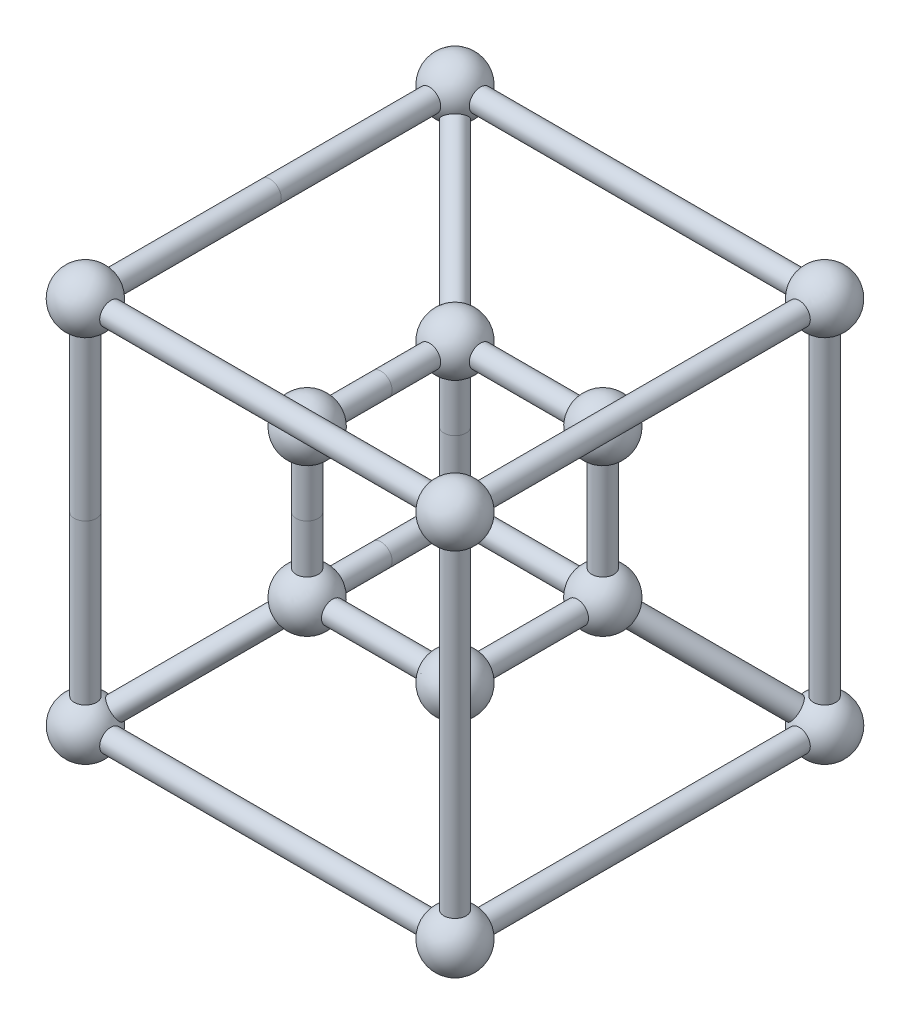
from build123d import *

# Parameters (mm, degrees)
SKETCH_9_R               = 3
PATTERN_CIRCULAR_1_COUNT = 4


with BuildPart() as part:
    # 扫描12: sweep along a path in 草图1
    with BuildLine(Plane(origin=(0, 0, 0), x_dir=(1, 0, 0), z_dir=(0, 1, 0))) as sweep_12_path:
        Line((-50, 50), (50, 50))
        Line((50, 50), (50, -50))
        Line((50, -50), (-50, -50))
        Line((-50, -50), (-50, 50))
    # 草图9 → 扫描12 (sweep)
    with BuildSketch(Plane.XY):
        with Locations((-50, 50)):
            Circle(SKETCH_9_R)
        with Locations((-20, 20)):
            Circle(SKETCH_9_R)
        with Locations((-20, -20)):
            Circle(SKETCH_9_R)
        with Locations((-50, -50)):
            Circle(SKETCH_9_R)
    sweep_12 = sweep(path=sweep_12_path.line, transition=Transition.RIGHT)

    # 草图11 → 旋转9 (revolve)
    with BuildSketch(Plane(origin=(0, 0, 0), x_dir=(0.7071067811865477, 0, 0.7071067811865475), z_dir=(-0.7071067811865475, 0, 0.7071067811865477)), mode=Mode.PRIVATE) as revolve_9_sk:
        with BuildLine():
            ThreePointArc((-66.830242846, -43.581883291), (-76.200602735, -44.890134277), (-76.834402476, -54.330127019))
            Line((-76.834402476, -54.330127019), (-22.160546891, -15.669872981))
            ThreePointArc((-22.160546891, -15.669872981), (-31.271923981, -13.12076086), (-35.628808135, -21.519137224))
            Line((-35.628808135, -21.519137224), (-66.830242846, -43.581883291))
        make_face()
        with BuildLine():
            ThreePointArc((32.16470652, 26.418116709), (22.794346631, 25.109865723), (22.160546891, 15.669872981))
            Line((22.160546891, 15.669872981), (76.834402476, 54.330127019))
            ThreePointArc((76.834402476, 54.330127019), (67.723025385, 56.87923914), (63.366141231, 48.480862776))
            Line((63.366141231, 48.480862776), (32.16470652, 26.418116709))
        make_face()
    revolve_9 = revolve(revolve_9_sk.sketch.rotate(Axis((-59.318971337, -59.318971337, -59.318971337), (0.5773502691896261, 0.5773502691896255, 0.5773502691896257)), 90), axis=Axis((-59.318971337, -59.318971337, -59.318971337), (0.5773502691896261, 0.5773502691896255, 0.5773502691896257)))

    # 阵列(圆周)1: 扫描12, 旋转9 ×4 about axis
    pattern_circular_1_axis = Axis((0, 0, 0), (1, 0, 0))
    add([sweep_12.rotate(pattern_circular_1_axis, i * 360 / PATTERN_CIRCULAR_1_COUNT) for i in range(1, PATTERN_CIRCULAR_1_COUNT)])
    add([revolve_9.rotate(pattern_circular_1_axis, i * 360 / PATTERN_CIRCULAR_1_COUNT) for i in range(1, PATTERN_CIRCULAR_1_COUNT)])


solid = part.part
